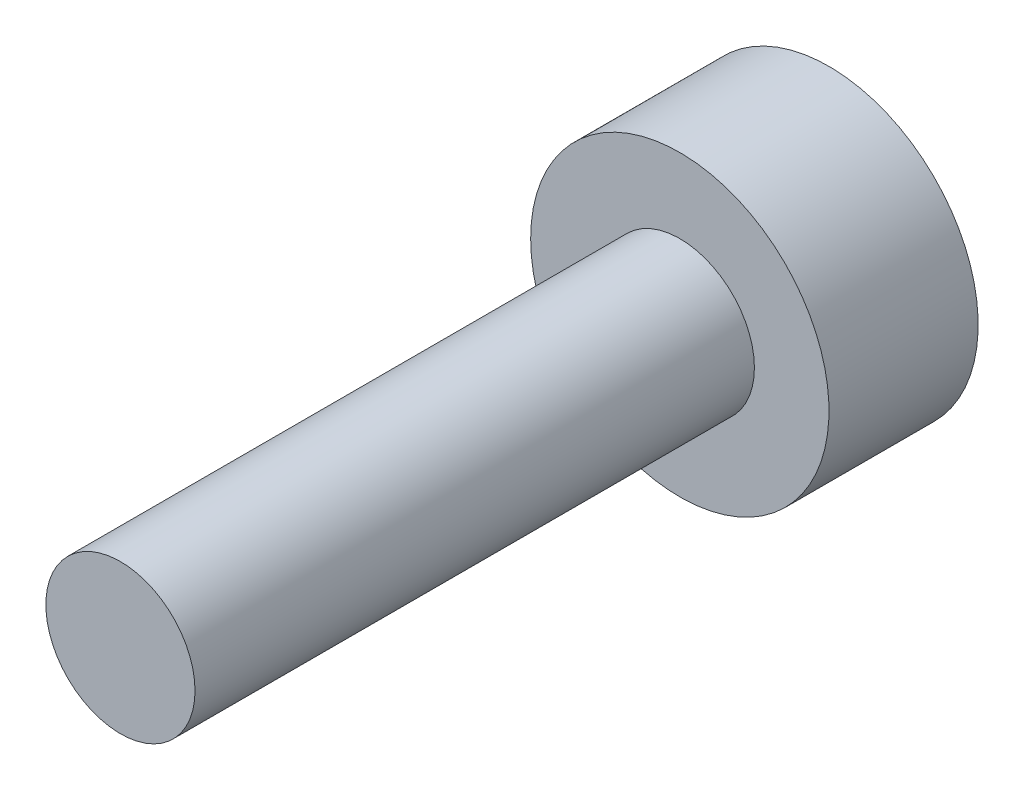
from build123d import *

# Parameters (mm, degrees)
SKETCH_1_R          = 0.8
EXTRUDE_1_DEPTH     = 6
SKETCH_2_R          = 1.6
EXTRUDE_2_DEPTH     = 1.6
CUT_EXTRUDE_1_DEPTH = 0.8


with BuildPart() as part:
    # 草图1 → 凸台-拉伸1 (new body)
    with BuildSketch(Plane.XY):
        Circle(SKETCH_1_R)
    extrude(amount=EXTRUDE_1_DEPTH)

    # 草图2 → 凸台-拉伸2 (add)
    with BuildSketch(Plane(origin=(0, 0, 0), x_dir=(-1, 0, 0), z_dir=(0, 0, -1))):
        Circle(SKETCH_2_R)
    extrude(amount=EXTRUDE_2_DEPTH)

    # 草图3 → 切除-拉伸1 (cut)
    with BuildSketch(Plane(origin=(0, 0, -1.6), x_dir=(-1, 0, 0), z_dir=(0, 0, -1))):
        Polygon((0.8, 0), (0.4, 0.692820323), (-0.4, 0.692820323), (-0.8, 0), (-0.4, -0.692820323), (0.4, -0.692820323), align=None)
    extrude(amount=-CUT_EXTRUDE_1_DEPTH, mode=Mode.SUBTRACT)


solid = part.part
